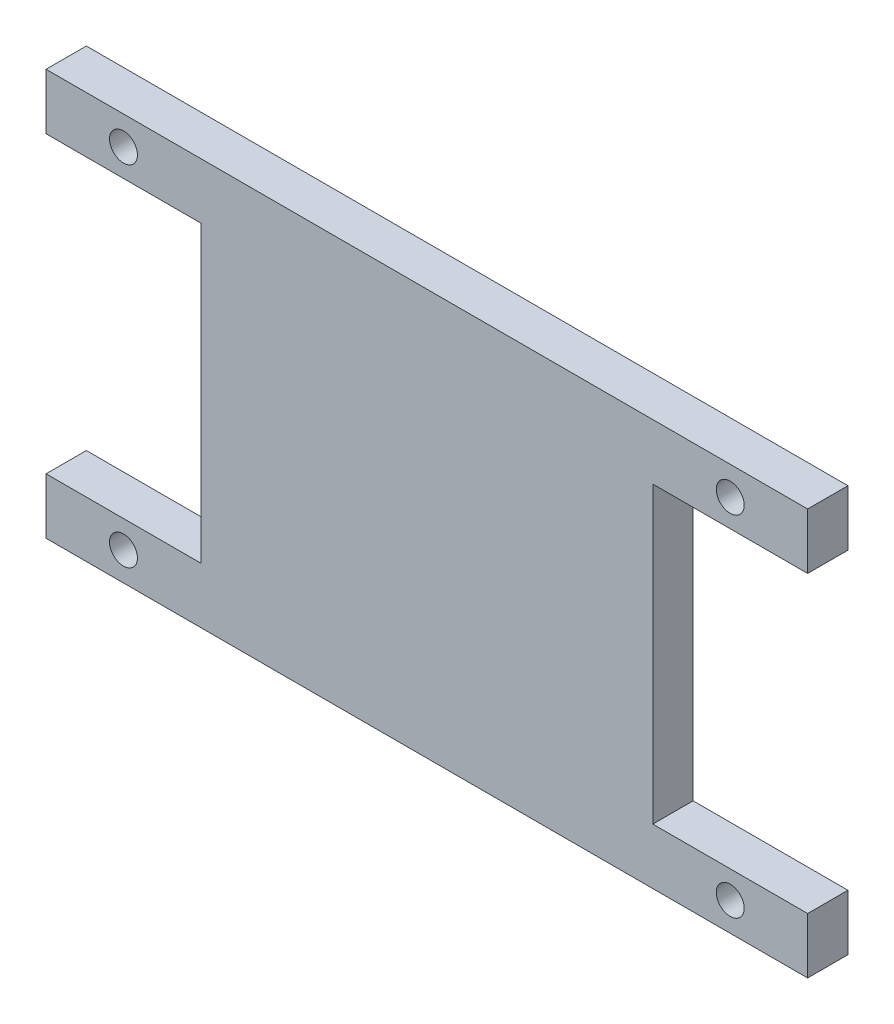
from build123d import *

# Parameters (mm, degrees)
SKETCH1_R           = 1.1
BOSS_EXTRUDE1_DEPTH = 3.175


with BuildPart() as part:
    # Sketch1 → Boss-Extrude1 (new body)
    with BuildSketch(Plane.XY):
        Polygon((0, 4.4), (0, 0), (60, 0), (60, 4.4), (47.8, 4.4), (47.8, 27.6), (60, 27.6), (60, 32), (0, 32), (0, 27.6), (12.2, 27.6), (12.2, 4.4), align=None)
        with Locations((6.1, 2.25)):
            Circle(SKETCH1_R, mode=Mode.SUBTRACT)
        with Locations((53.9, 2.25)):
            Circle(SKETCH1_R, mode=Mode.SUBTRACT)
        with Locations((6.1, 29.75)):
            Circle(SKETCH1_R, mode=Mode.SUBTRACT)
        with Locations((53.9, 29.75)):
            Circle(SKETCH1_R, mode=Mode.SUBTRACT)
    extrude(amount=BOSS_EXTRUDE1_DEPTH)


solid = part.part
